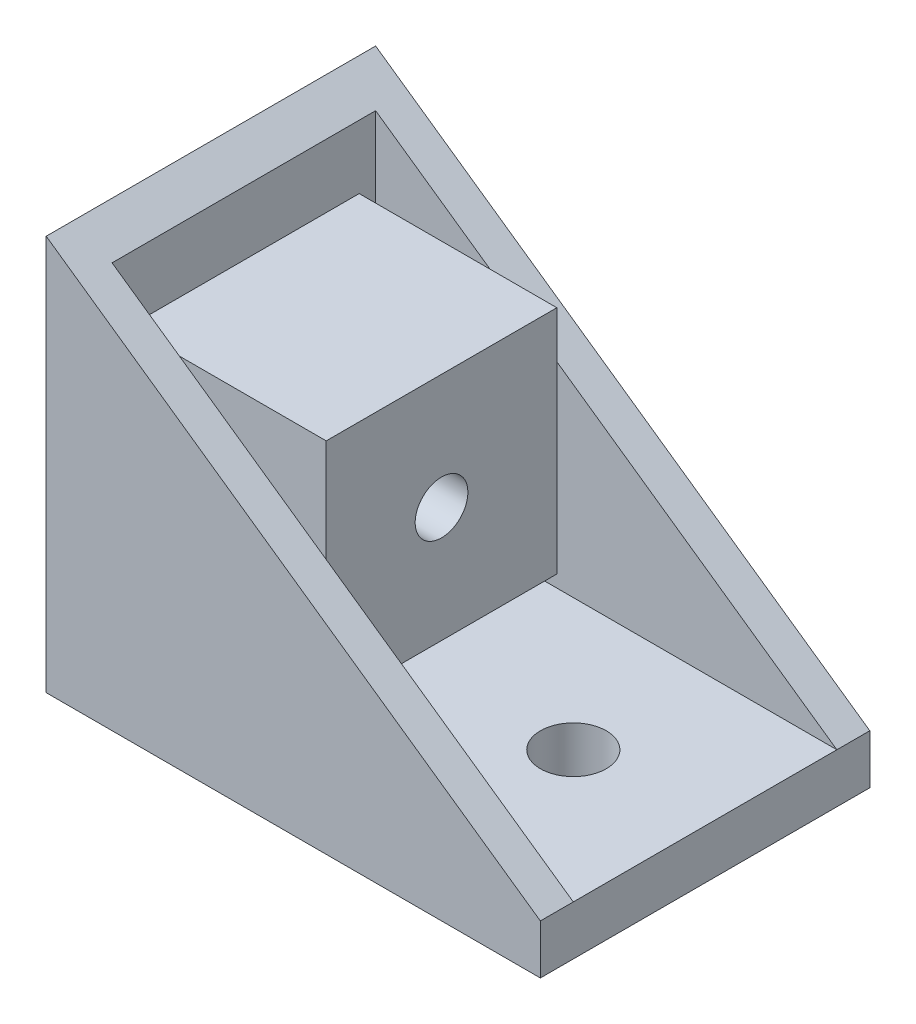
from build123d import *

# Parameters (mm, degrees)
CROQUIS1_W              = 30
CROQUIS1_H              = 20
SALIENTE_EXTRUIR1_DEPTH = 24
CORTAR_EXTRUIR1_DEPTH   = 35.655446902
VACIADO1_T              = -2
CROQUIS5_W              = 16
CROQUIS5_H              = 7.775934249
CORTAR_EXTRUIR3_DEPTH   = 24
SALIENTE_EXTRUIR2_REACH = 41.699
CROQUIS6_W              = 16
CROQUIS6_H              = 3
CROQUIS7_W              = 14
CROQUIS7_H              = 14
SALIENTE_EXTRUIR3_DEPTH = 12
CROQUIS8_R              = 1.6
CORTAR_EXTRUIR5_DEPTH   = 31.528675045
CROQUIS9_R              = 2
CORTAR_EXTRUIR6_DEPTH   = 12


with BuildPart() as part:
    # Croquis1 → Saliente-Extruir1 (new body)
    with BuildSketch(Plane(origin=(0, 0, 0), x_dir=(1, 0, 0), z_dir=(0, 1, 0))):
        Rectangle(CROQUIS1_W, CROQUIS1_H)
    extrude(amount=SALIENTE_EXTRUIR1_DEPTH)

    # Croquis2 → Cortar-Extruir1 (cut, through all)
    with BuildSketch(Plane.XY.offset(10)):
        Polygon((-15, 24), (15, 3), (15, 24), align=None)
    extrude(amount=-CORTAR_EXTRUIR1_DEPTH, mode=Mode.SUBTRACT)

    # Vaciado1
    vaciado1_openings = [part.faces().sort_by_distance(p)[0] for p in [
        (0, 13.5, 0),
    ]]
    offset(amount=VACIADO1_T, openings=vaciado1_openings, kind=Kind.INTERSECTION)

    # Croquis5 → Cortar-Extruir3 (cut)
    with BuildSketch(Plane(origin=(15, 0, 0), x_dir=(0, 0, -1), z_dir=(1, 0, 0))):
        with Locations((0, 6.887967125)):
            Rectangle(CROQUIS5_W, CROQUIS5_H)
    extrude(amount=-CORTAR_EXTRUIR3_DEPTH, mode=Mode.SUBTRACT)

    # Croquis6 → Saliente-Extruir2 (add, up to next)
    with BuildSketch(Plane(origin=(15, 0, 0), x_dir=(0, 0, -1), z_dir=(1, 0, 0)), mode=Mode.PRIVATE) as saliente_extruir2_sk1:
        with Locations((0, 1.5)):
            Rectangle(CROQUIS6_W, CROQUIS6_H)
    saliente_extruir2_tool1 = extrude(saliente_extruir2_sk1.sketch, amount=-SALIENTE_EXTRUIR2_REACH, mode=Mode.PRIVATE) - part.part
    add(saliente_extruir2_tool1.solids().sort_by_distance((15, 1.5, 0))[0])

    # Croquis7 → Saliente-Extruir3 (add)
    with BuildSketch(Plane(origin=(-13, 0, 0), x_dir=(0, 0, -1), z_dir=(1, 0, 0))):
        with Locations((0, 11.74)):
            Rectangle(CROQUIS7_W, CROQUIS7_H)
    extrude(amount=SALIENTE_EXTRUIR3_DEPTH)

    # Croquis8 → Cortar-Extruir5 (cut, through all)
    with BuildSketch(Plane(origin=(-1, 0, 0), x_dir=(0, 0, -1), z_dir=(1, 0, 0))):
        with Locations((0, 11.74)):
            Circle(CROQUIS8_R)
    extrude(amount=-CORTAR_EXTRUIR5_DEPTH, mode=Mode.SUBTRACT)

    # Croquis9 → Cortar-Extruir6 (cut)
    with BuildSketch(Plane.XZ):
        with Locations(Location((7, 0, 0), (0, 0, 270))):
            Circle(CROQUIS9_R)
    extrude(amount=-CORTAR_EXTRUIR6_DEPTH, mode=Mode.SUBTRACT)


solid = part.part
